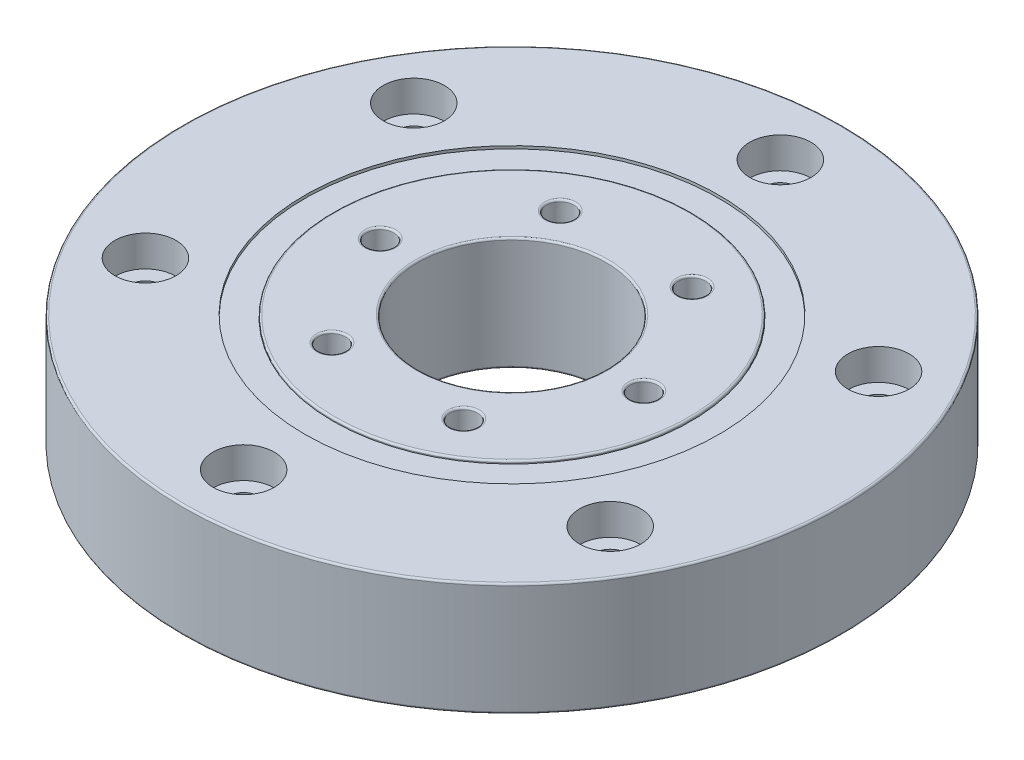
from build123d import *

# Parameters (mm, degrees)
SKETCH_1_R          = 35
SKETCH_1_R_2        = 10
SKETCH_1_R_3        = 1.45
SKETCH_1_R_4        = 1.7
EXTRUDE_1_DEPTH     = 6
SKETCH_2_R          = 22
SKETCH_2_R_2        = 19
CUT_EXTRUDE_1_DEPTH = 0.3
CUT_EXTRUDE_START   = -0.3
SKETCH_3_R          = 22
SKETCH_3_R_2        = 19
CUT_EXTRUDE_2_DEPTH = 0.3
FILLET_1_R          = 0.2
SKETCH_4_R          = 3.25
CUT_EXTRUDE_3_DEPTH = 3.3


with BuildPart() as part:
    # 草图1 → 凸台-拉伸1 (new, symmetric)
    with BuildSketch(Plane(origin=(0, 0, 0), x_dir=(1, 0, 0), z_dir=(0, 1, 0))):
        with Locations(Location((0, 0, 0), (0, 0, 270))):
            Circle(SKETCH_1_R)
        with Locations(Location((0, 0, 0), (0, 0, 270))):
            Circle(SKETCH_1_R_2, mode=Mode.SUBTRACT)
        with Locations(Location((-7, 12.124355653, 0), (0, 0, 270))):
            Circle(SKETCH_1_R_3, mode=Mode.SUBTRACT)
        with Locations(Location((7, 12.124355653, 0), (0, 0, 270))):
            Circle(SKETCH_1_R_3, mode=Mode.SUBTRACT)
        with Locations(Location((14, 0, 0), (0, 0, 270))):
            Circle(SKETCH_1_R_3, mode=Mode.SUBTRACT)
        with Locations(Location((7, -12.124355653, 0), (0, 0, 270))):
            Circle(SKETCH_1_R_3, mode=Mode.SUBTRACT)
        with Locations(Location((-7, -12.124355653, 0), (0, 0, 270))):
            Circle(SKETCH_1_R_3, mode=Mode.SUBTRACT)
        with Locations(Location((-14, 0, 0), (0, 0, 270))):
            Circle(SKETCH_1_R_3, mode=Mode.SUBTRACT)
        with Locations(Location((0, 28.5, 0), (0, 0, 270))):
            Circle(SKETCH_1_R_4, mode=Mode.SUBTRACT)
        with Locations(Location((24.681724008, 14.25, 0), (0, 0, 270))):
            Circle(SKETCH_1_R_4, mode=Mode.SUBTRACT)
        with Locations(Location((24.681724008, -14.25, 0), (0, 0, 270))):
            Circle(SKETCH_1_R_4, mode=Mode.SUBTRACT)
        with Locations(Location((0, -28.5, 0), (0, 0, 270))):
            Circle(SKETCH_1_R_4, mode=Mode.SUBTRACT)
        with Locations(Location((-24.681724008, -14.25, 0), (0, 0, 270))):
            Circle(SKETCH_1_R_4, mode=Mode.SUBTRACT)
        with Locations(Location((-24.681724008, 14.25, 0), (0, 0, 270))):
            Circle(SKETCH_1_R_4, mode=Mode.SUBTRACT)
    extrude(amount=EXTRUDE_1_DEPTH, both=True)

    # 草图2 → 切除-拉伸1 (cut)
    with BuildSketch(Plane(origin=(0, 6, 0), x_dir=(1, 0, 0), z_dir=(0, 1, 0))):
        with Locations(Location((0, 0, 0), (0, 0, 270))):
            Circle(SKETCH_2_R)
        with Locations(Location((0, 0, 0), (0, 0, 270))):
            Circle(SKETCH_2_R_2, mode=Mode.SUBTRACT)
    extrude(amount=-CUT_EXTRUDE_1_DEPTH, mode=Mode.SUBTRACT)

    # 草图3 → 切除-拉伸2 (cut)
    with BuildSketch(Plane.XZ.offset(6).offset(CUT_EXTRUDE_START)):
        with Locations(Location((0, 0, 0), (0, 0, 90))):
            Circle(SKETCH_3_R)
        with Locations(Location((0, 0, 0), (0, 0, 90))):
            Circle(SKETCH_3_R_2, mode=Mode.SUBTRACT)
    extrude(amount=CUT_EXTRUDE_2_DEPTH, mode=Mode.SUBTRACT)

    # 圆角1
    fillet_1_edges = [part.edges().sort_by_distance(p)[0] for p in [
        (7, -6, -13.574355653),
        (7, 6, -13.574355653),
        (14, -6, -1.45),
        (14, 6, -1.45),
        (0, -6, -35),
        (7, -6, 10.674355653),
        (7, 6, 10.674355653),
        (-7, -6, 10.674355653),
        (-7, 6, 10.674355653),
        (-14, -6, -1.45),
        (-14, 6, -1.45),
        (24.681724008, -6, -15.95),
        (0, -6, -30.2),
        (24.681724008, -6, 12.55),
        (0, -6, 26.8),
        (-24.681724008, -6, 12.55),
        (0, 6, -35),
        (-24.681724008, -6, -15.95),
        (0, -6, -10),
        (0, 6, -10),
        (0, 6, -19),
        (0, -6, -19),
        (-7, -6, -13.574355653),
        (-7, 6, -13.574355653),
    ]]
    fillet(fillet_1_edges, radius=FILLET_1_R)

    # 草图4 → 切除-拉伸3 (cut)
    with BuildSketch(Plane(origin=(0, 6, 0), x_dir=(1, 0, 0), z_dir=(0, 1, 0))):
        with Locations(Location((0, 28.5, 0), (0, 0, 270))):
            Circle(SKETCH_4_R)
        with Locations(Location((24.681724008, 14.25, 0), (0, 0, 270))):
            Circle(SKETCH_4_R)
        with Locations(Location((24.681724008, -14.25, 0), (0, 0, 270))):
            Circle(SKETCH_4_R)
        with Locations(Location((0, -28.5, 0), (0, 0, 270))):
            Circle(SKETCH_4_R)
        with Locations(Location((-24.681724008, -14.25, 0), (0, 0, 270))):
            Circle(SKETCH_4_R)
        with Locations(Location((-24.681724008, 14.25, 0), (0, 0, 270))):
            Circle(SKETCH_4_R)
    extrude(amount=-CUT_EXTRUDE_3_DEPTH, mode=Mode.SUBTRACT)


solid = part.part
